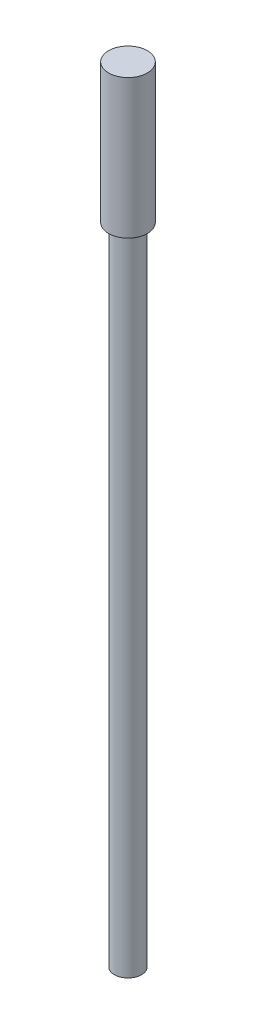
from build123d import *

# Parameters (mm, degrees)
SKETCH_1_R      = 10.75
SKETCH_1_R_2    = 7.75
EXTRUDE_1_DEPTH = 620
SKETCH_2_R      = 15.301580628
EXTRUDE_2_DEPTH = 110


with BuildPart() as part:
    # Эскиз1 → Бобышка-Вытянуть1 (new body)
    with BuildSketch(Plane(origin=(0, 0, 0), x_dir=(1, 0, 0), z_dir=(0, 1, 0))):
        with Locations(Location((0, 0, 0), (0, 0, 270))):
            Circle(SKETCH_1_R)
        with Locations(Location((0, 0, 0), (0, 0, 270))):
            Circle(SKETCH_1_R_2, mode=Mode.SUBTRACT)
    extrude(amount=EXTRUDE_1_DEPTH)

    # Эскиз2 → Бобышка-Вытянуть2 (add)
    with BuildSketch(Plane(origin=(0, 620, 0), x_dir=(1, 0, 0), z_dir=(0, 1, 0))):
        with Locations(Location((0, 0, 0), (0, 0, 270))):
            Circle(SKETCH_2_R)
    extrude(amount=-EXTRUDE_2_DEPTH)


solid = part.part
